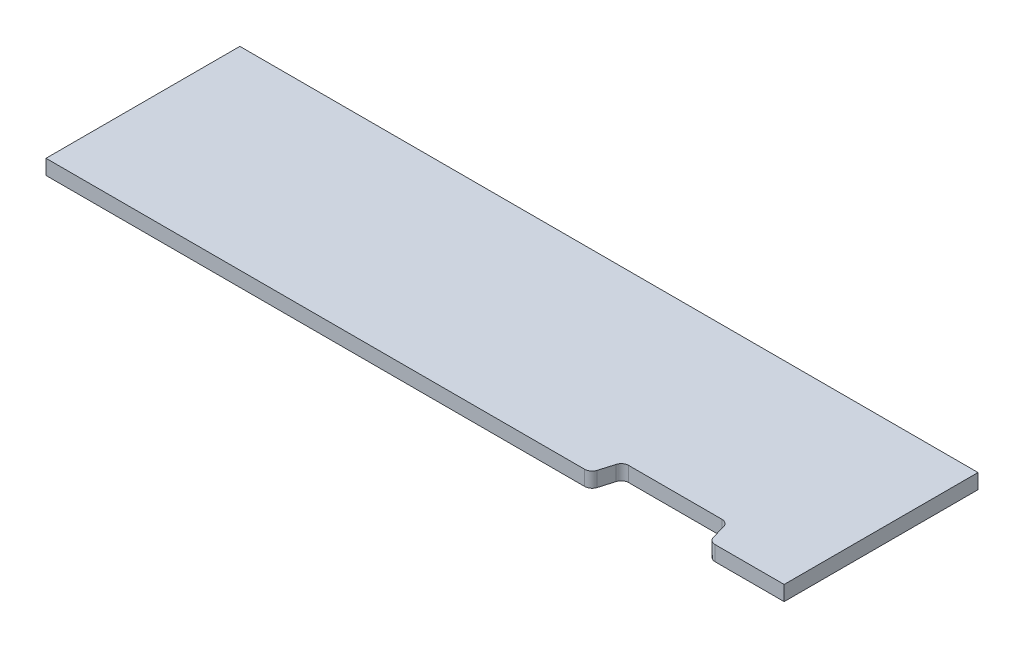
from build123d import *

# Parameters (mm, degrees)
SKETCH1_W           = 628.65
SKETCH1_H           = 165.1
BOSS_EXTRUDE1_DEPTH = 12.7
CUT_EXTRUDE1_DEPTH  = 12.7
FILLET1_R           = 6.35


with BuildPart() as part:
    # Sketch1 → Boss-Extrude1 (new body)
    with BuildSketch(Plane(origin=(0, 0, 0), x_dir=(1, 0, 0), z_dir=(0, 1, 0))):
        Rectangle(SKETCH1_W, SKETCH1_H)
    extrude(amount=BOSS_EXTRUDE1_DEPTH)

    # Sketch2 → Cut-Extrude1 (cut)
    with BuildSketch(Plane.XZ):
        Polygon((149.225, 82.55), (250.825, 82.55), (244.475, 60.96), (155.575, 60.96), align=None)
    extrude(amount=-CUT_EXTRUDE1_DEPTH, mode=Mode.SUBTRACT)

    # Fillet1
    fillet1_edges = [part.edges().sort_by_distance(p)[0] for p in [
        (155.575, 6.35, 60.96),
        (149.225, 6.35, 82.55),
        (250.825, 6.35, 82.55),
        (244.475, 6.35, 60.96),
    ]]
    fillet(fillet1_edges, radius=FILLET1_R)


solid = part.part
